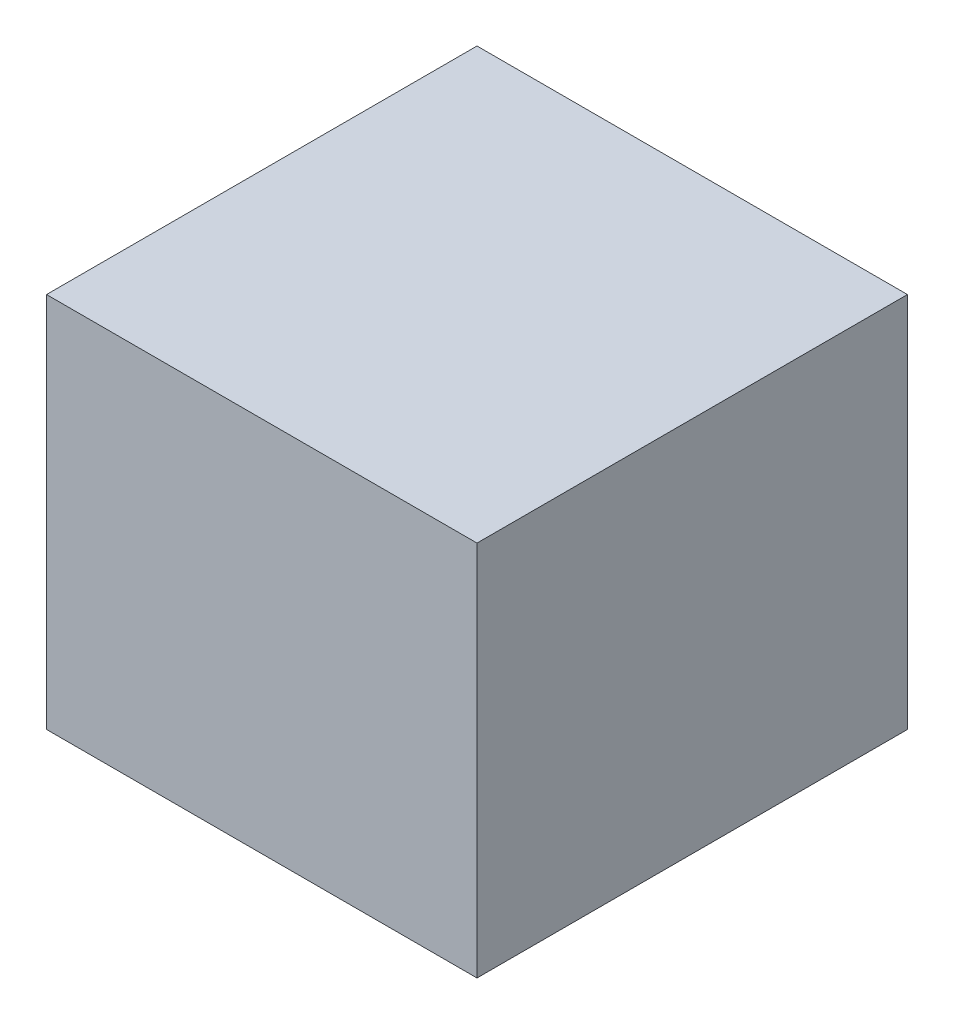
from build123d import *

# Parameters (mm, degrees)
SKETCH_1_W      = 40
SKETCH_1_H      = 40
EXTRUDE_1_DEPTH = 35


with BuildPart() as part:
    # Эскиз1 → Бобышка-Вытянуть1 (new body)
    with BuildSketch(Plane(origin=(0, 0, 0), x_dir=(1, 0, 0), z_dir=(0, 1, 0))):
        with Locations((-30.807799443, -4.456824513)):
            Rectangle(SKETCH_1_W, SKETCH_1_H)
    extrude(amount=EXTRUDE_1_DEPTH)


solid = part.part
